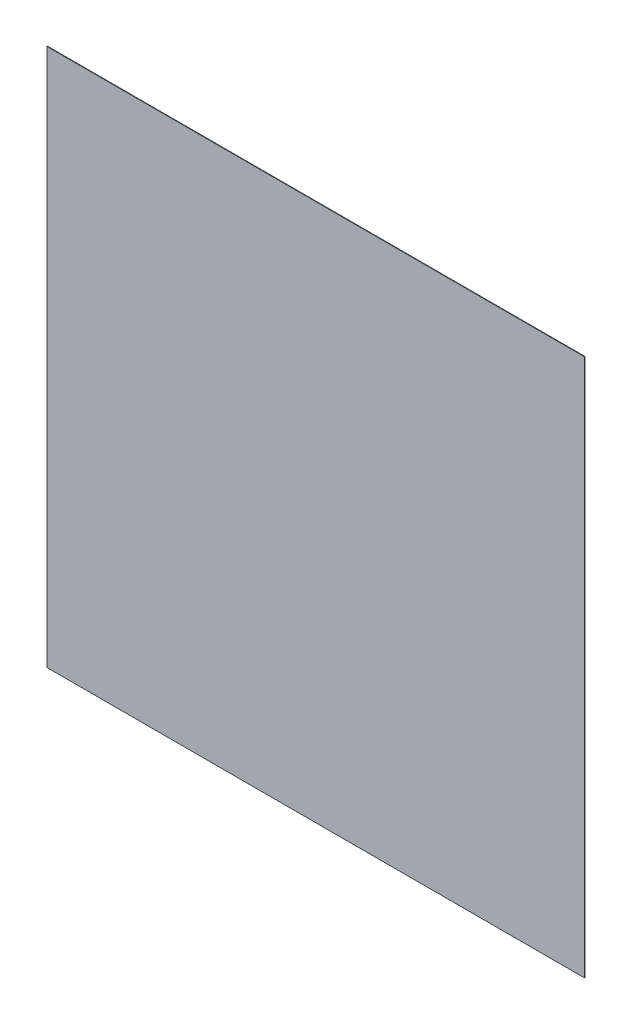
from build123d import *

# Parameters (mm, degrees)
SKETCH1_W           = 2540
SKETCH1_H           = 2540
BOSS_EXTRUDE1_DEPTH = 2.54


with BuildPart() as part:
    # Sketch1 → Boss-Extrude1 (new body)
    with BuildSketch(Plane(origin=(0, 0, 0), x_dir=(0, 1, 0), z_dir=(0, 0, 1))):
        Rectangle(SKETCH1_W, SKETCH1_H)
    extrude(amount=BOSS_EXTRUDE1_DEPTH)


solid = part.part
